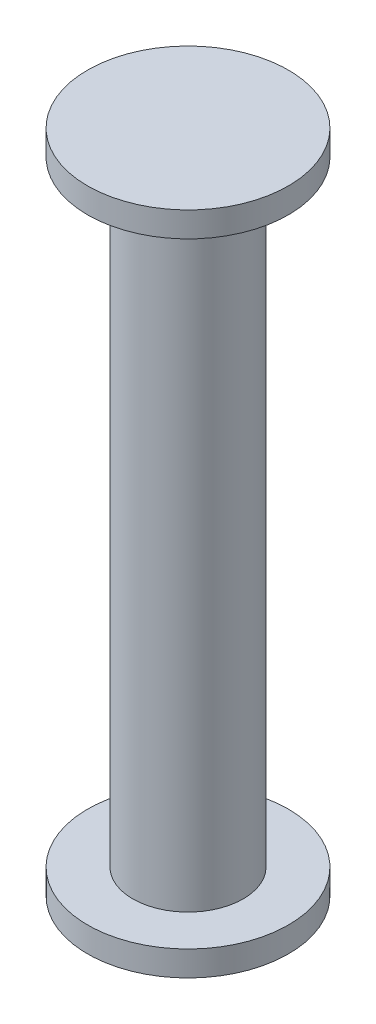
from build123d import *

# Parameters (mm, degrees)
SKETCH1_R           = 2.2
BOSS_EXTRUDE1_DEPTH = 24.5
SKETCH2_R           = 4
BOSS_EXTRUDE2_DEPTH = 1
BOSS_EXTRUDE3_START = 1
SKETCH3_R           = 4
BOSS_EXTRUDE3_DEPTH = 1


with BuildPart() as part:
    # Sketch1 → Boss-Extrude1 (new body)
    with BuildSketch(Plane(origin=(0, 0, 0), x_dir=(1, 0, 0), z_dir=(0, 1, 0))):
        with Locations(Location((0, 0, 0), (0, 0, 270))):
            Circle(SKETCH1_R)
    extrude(amount=BOSS_EXTRUDE1_DEPTH)

    # Sketch2 → Boss-Extrude2 (add)
    with BuildSketch(Plane(origin=(0, 24.5, 0), x_dir=(1, 0, 0), z_dir=(0, 1, 0))):
        with Locations(Location((0, 0, 0), (0, 0, 270))):
            Circle(SKETCH2_R)
    extrude(amount=BOSS_EXTRUDE2_DEPTH)

    # Sketch3 → Boss-Extrude3 (add)
    with BuildSketch(Plane.XZ.offset(BOSS_EXTRUDE3_START)):
        with Locations(Location((0, 0, 0), (0, 0, 90))):
            Circle(SKETCH3_R)
    extrude(amount=-BOSS_EXTRUDE3_DEPTH)


solid = part.part
